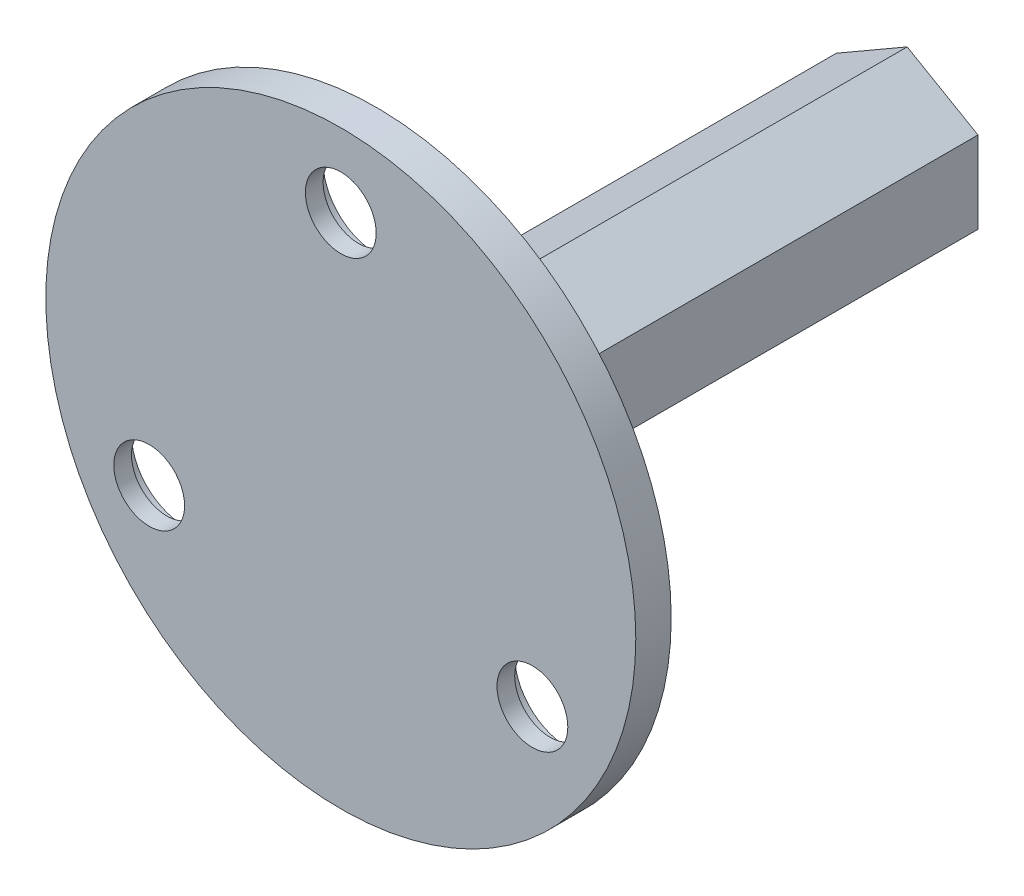
from build123d import *

# Parameters (mm, degrees)
SKETCH1_R           = 25
SKETCH1_R_2         = 3
BOSS_EXTRUDE1_DEPTH = 3
SKETCH2_R           = 7.5
BOSS_EXTRUDE2_DEPTH = 10
BOSS_EXTRUDE3_DEPTH = 35
SKETCH4_R           = 1.25
CUT_EXTRUDE1_DEPTH  = 10
SKETCH5_R           = 12.5
SKETCH5_R_2         = 11
BOSS_EXTRUDE4_DEPTH = 0.5
SKETCH6_R           = 4.5
CUT_EXTRUDE2_DEPTH  = 1.5


with BuildPart() as part:
    # Sketch1 → Boss-Extrude1 (new body)
    with BuildSketch(Plane.XY):
        Circle(SKETCH1_R)
        with Locations((0, 18.75)):
            Circle(SKETCH1_R_2, mode=Mode.SUBTRACT)
        with Locations((16.237976321, -9.375)):
            Circle(SKETCH1_R_2, mode=Mode.SUBTRACT)
        with Locations((-16.237976321, -9.375)):
            Circle(SKETCH1_R_2, mode=Mode.SUBTRACT)
    extrude(amount=BOSS_EXTRUDE1_DEPTH)

    # Sketch2 → Boss-Extrude2 (add)
    with BuildSketch(Plane(origin=(0, 0, 0), x_dir=(-1, 0, 0), z_dir=(0, 0, -1))):
        with Locations(Location((0, 0, 0), (0, 0, 180))):
            Circle(SKETCH2_R)
    extrude(amount=BOSS_EXTRUDE2_DEPTH)

    # Sketch3 → Boss-Extrude3 (add)
    with BuildSketch(Plane(origin=(0, 0, -10), x_dir=(-1, 0, 0), z_dir=(0, 0, -1))):
        Polygon((0, -6.92820323), (6, -3.464101615), (6, 3.464101615), (0, 6.92820323), (-6, 3.464101615), (-6, -3.464101615), align=None)
    extrude(amount=BOSS_EXTRUDE3_DEPTH)

    # Sketch4 → Cut-Extrude1 (cut)
    with BuildSketch(Plane(origin=(0, 0, -45), x_dir=(-1, 0, 0), z_dir=(0, 0, -1))):
        Circle(SKETCH4_R)
    extrude(amount=-CUT_EXTRUDE1_DEPTH, mode=Mode.SUBTRACT)

    # Sketch5 → Boss-Extrude4 (add)
    with BuildSketch(Plane(origin=(0, 0, 0), x_dir=(-1, 0, 0), z_dir=(0, 0, -1))):
        with Locations(Location((0, 0, 0), (0, 0, 180))):
            Circle(SKETCH5_R)
        Circle(SKETCH5_R_2, mode=Mode.SUBTRACT)
    extrude(amount=BOSS_EXTRUDE4_DEPTH)

    # Sketch6 → Cut-Extrude2 (cut)
    with BuildSketch(Plane(origin=(0, 0, 0), x_dir=(-1, 0, 0), z_dir=(0, 0, -1))):
        with Locations((0, 18.75)):
            Circle(SKETCH6_R)
        with Locations((16.237976321, -9.375)):
            Circle(SKETCH6_R)
        with Locations((-16.237976321, -9.375)):
            Circle(SKETCH6_R)
    extrude(amount=-CUT_EXTRUDE2_DEPTH, mode=Mode.SUBTRACT)


solid = part.part
